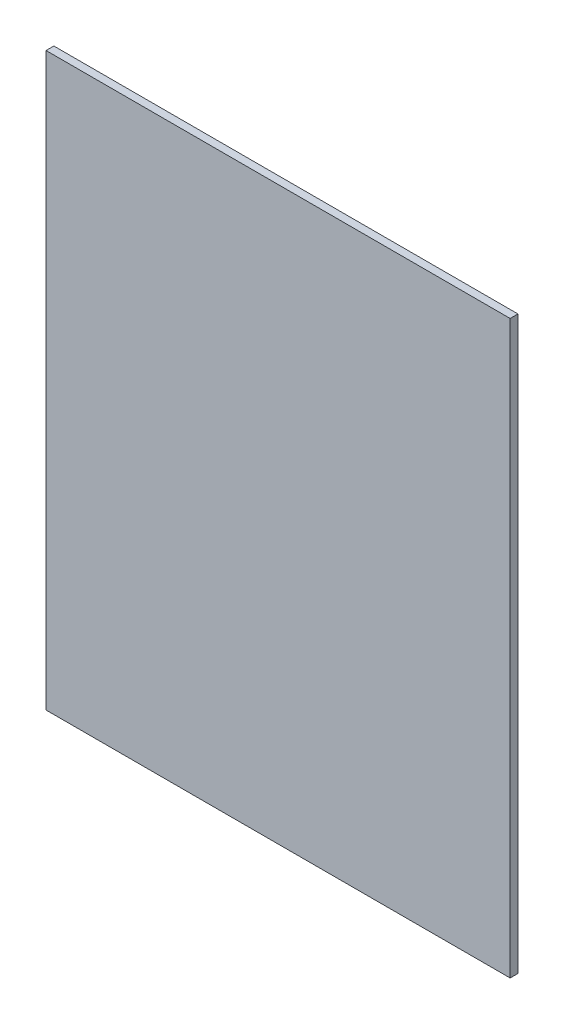
from build123d import *

# Parameters (mm, degrees)
SKETCH1_W           = 660.4
SKETCH1_H           = 812.8
BOSS_EXTRUDE1_DEPTH = 11.1125


with BuildPart() as part:
    # Sketch1 → Boss-Extrude1 (new body)
    with BuildSketch(Plane.XY):
        with Locations((330.2, 406.4)):
            Rectangle(SKETCH1_W, SKETCH1_H)
    extrude(amount=BOSS_EXTRUDE1_DEPTH)


solid = part.part
